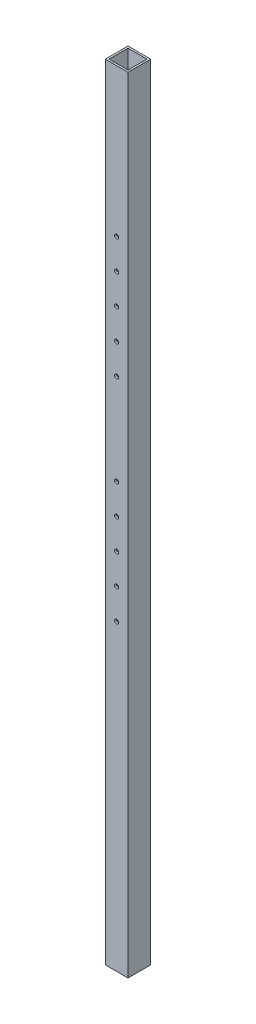
from build123d import *

# Parameters (mm, degrees)
SKETCH1_W                 = 19.05
SKETCH1_H                 = 19.05
SKETCH1_W_2               = 15.875
SKETCH1_H_2               = 15.875
BOSS_EXTRUDE1_DEPTH       = 328.6633
SKETCH2_R                 = 1.7145
CUT_EXTRUDE1_DEPTH        = 330.352687695
LPATTERN1_COUNT           = 5
LPATTERN1_PITCH           = 25.4
LPATTERN2_COUNT           = 2
LPATTERN2_PITCH           = 177.8
LPATTERN2_COPY_1_SKETCH_R = 1.7145
LPATTERN2_COPY_1_DEPTH    = 330.352687695
LPATTERN2_COPY_2_SKETCH_R = 1.7145
LPATTERN2_COPY_2_DEPTH    = 330.352687695
LPATTERN2_COPY_3_SKETCH_R = 1.7145
LPATTERN2_COPY_3_DEPTH    = 330.352687695
LPATTERN2_COPY_4_SKETCH_R = 1.7145
LPATTERN2_COPY_4_DEPTH    = 330.352687695


with BuildPart() as part:
    # Sketch1 → Boss-Extrude1 (new, symmetric)
    with BuildSketch(Plane.ZX):
        Rectangle(SKETCH1_W, SKETCH1_H)
        Rectangle(SKETCH1_W_2, SKETCH1_H_2, mode=Mode.SUBTRACT)
    extrude(amount=BOSS_EXTRUDE1_DEPTH, both=True)

    # Sketch2 → Cut-Extrude1 (cut, through all)
    with BuildSketch(Plane.XY.offset(9.525)):
        with Locations((0, -74.6633)):
            Circle(SKETCH2_R)
    cut_extrude1 = extrude(amount=-CUT_EXTRUDE1_DEPTH, mode=Mode.SUBTRACT)

    # LPattern1: Cut-Extrude1 ×5
    with Locations(*[(0, i * LPATTERN1_PITCH, 0) for i in range(1, LPATTERN1_COUNT)]):
        add(cut_extrude1, mode=Mode.SUBTRACT)

    # LPattern2: Cut-Extrude1 ×2
    with Locations(*[(0, i * LPATTERN2_PITCH, 0) for i in range(1, LPATTERN2_COUNT)]):
        add(cut_extrude1, mode=Mode.SUBTRACT)

    # LPattern2 copy 1 sketch → LPattern2 copy 1 (cut, through all)
    with BuildSketch(Plane(origin=(0, 203.2, 9.525), x_dir=(1, 0, 0), z_dir=(0, 0, 1))):
        with Locations((0, -74.6633)):
            Circle(LPATTERN2_COPY_1_SKETCH_R)
    extrude(amount=-LPATTERN2_COPY_1_DEPTH, mode=Mode.SUBTRACT)

    # LPattern2 copy 2 sketch → LPattern2 copy 2 (cut, through all)
    with BuildSketch(Plane(origin=(0, 228.6, 9.525), x_dir=(1, 0, 0), z_dir=(0, 0, 1))):
        with Locations((0, -74.6633)):
            Circle(LPATTERN2_COPY_2_SKETCH_R)
    extrude(amount=-LPATTERN2_COPY_2_DEPTH, mode=Mode.SUBTRACT)

    # LPattern2 copy 3 sketch → LPattern2 copy 3 (cut, through all)
    with BuildSketch(Plane(origin=(0, 254, 9.525), x_dir=(1, 0, 0), z_dir=(0, 0, 1))):
        with Locations((0, -74.6633)):
            Circle(LPATTERN2_COPY_3_SKETCH_R)
    extrude(amount=-LPATTERN2_COPY_3_DEPTH, mode=Mode.SUBTRACT)

    # LPattern2 copy 4 sketch → LPattern2 copy 4 (cut, through all)
    with BuildSketch(Plane(origin=(0, 279.4, 9.525), x_dir=(1, 0, 0), z_dir=(0, 0, 1))):
        with Locations((0, -74.6633)):
            Circle(LPATTERN2_COPY_4_SKETCH_R)
    extrude(amount=-LPATTERN2_COPY_4_DEPTH, mode=Mode.SUBTRACT)


solid = part.part
